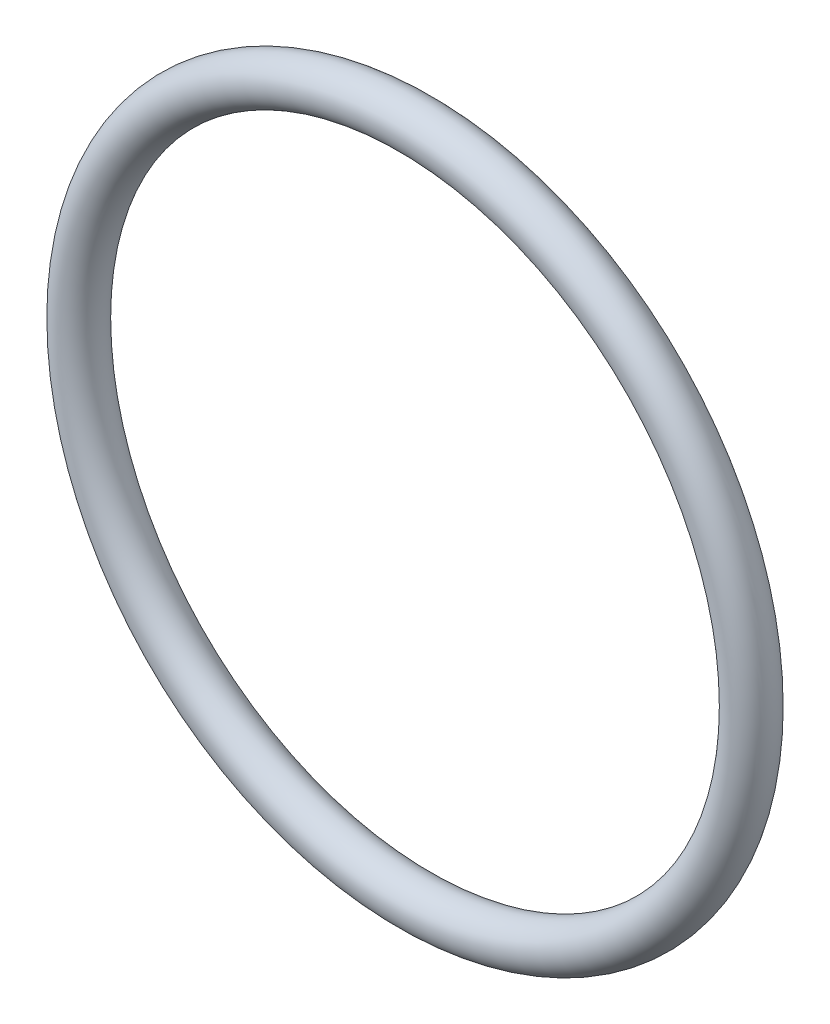
from build123d import *

# Parameters (mm, degrees)
SKETCH_1_R = 0.9


with BuildPart() as part:
    # 草图1 → 旋转2 (revolve)
    with BuildSketch(Plane(origin=(0, 0, 0), x_dir=(0, 0, -1), z_dir=(1, 0, 0)), mode=Mode.PRIVATE) as revolve_2_sk:
        with Locations((0, 13.4)):
            Circle(SKETCH_1_R)
    revolve(revolve_2_sk.sketch.rotate(Axis((0, 0, 15.026058728), (0, 0, -1)), 90), axis=Axis((0, 0, 15.026058728), (0, 0, -1)))


solid = part.part
